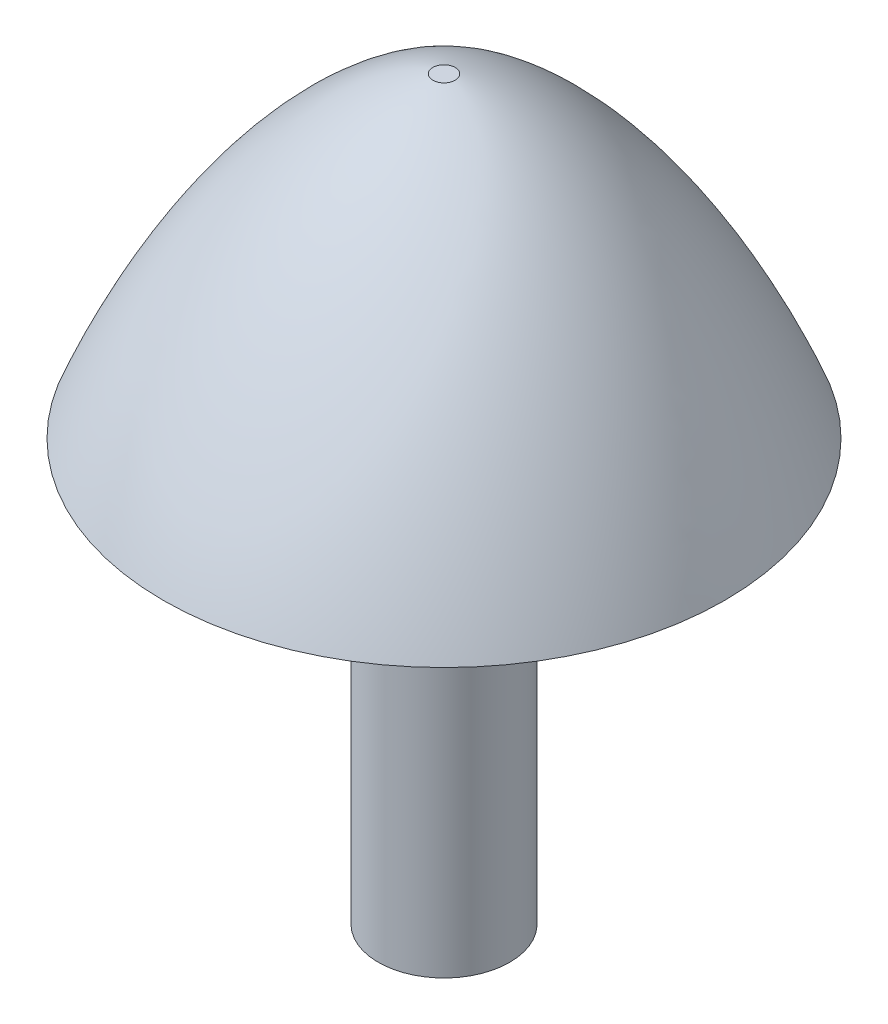
from build123d import *

# Parameters (mm, degrees)
CUT_EXTRUDE1_DEPTH      = 43.521318352
CUT_EXTRUDE1_DEPTH_BACK = 43.521318352
SKETCH1_W               = 53.107977593
SKETCH1_H               = 23.637371429
SKETCH5_R               = 3.96875
BOSS_EXTRUDE1_DEPTH     = 25.4


with BuildPart() as part:
    # 草图1 → 旋转1 (revolve)
    with BuildSketch(Plane.XY):
        with BuildLine():
            Line((0, 0), (0, 31.75))
            Line((0, 31.75), (0.671450483, 31.75))
            add(Edge.make_bspline(
                [(0.671450483, 31.75), (10.760339504, 29.131046737), (19.406701728, 11.219456234), (20, 0)],
                knots=[0.132414506, 0.132414506, 0.132414506, 0.132414506, 1, 1, 1, 1], degree=3))
            Line((20, 0), (0, 0))
        make_face()
    revolve(axis=Axis((0, 0, 0), (0, 1, 0)))

    # Sketch1 → Cut-Extrude1 (cut, two sides: drawn at the far end of the back side and taken through both)
    with BuildSketch(Plane.XY.offset(-CUT_EXTRUDE1_DEPTH_BACK)):
        with Locations((1.111771429, 0.881314286)):
            Rectangle(SKETCH1_W, SKETCH1_H)
    extrude(amount=CUT_EXTRUDE1_DEPTH + CUT_EXTRUDE1_DEPTH_BACK, mode=Mode.SUBTRACT)

    # Sketch5 → Boss-Extrude1 (add)
    with BuildSketch(Plane.XZ.offset(-12.7)):
        Circle(SKETCH5_R)
    extrude(amount=BOSS_EXTRUDE1_DEPTH)


solid = part.part
